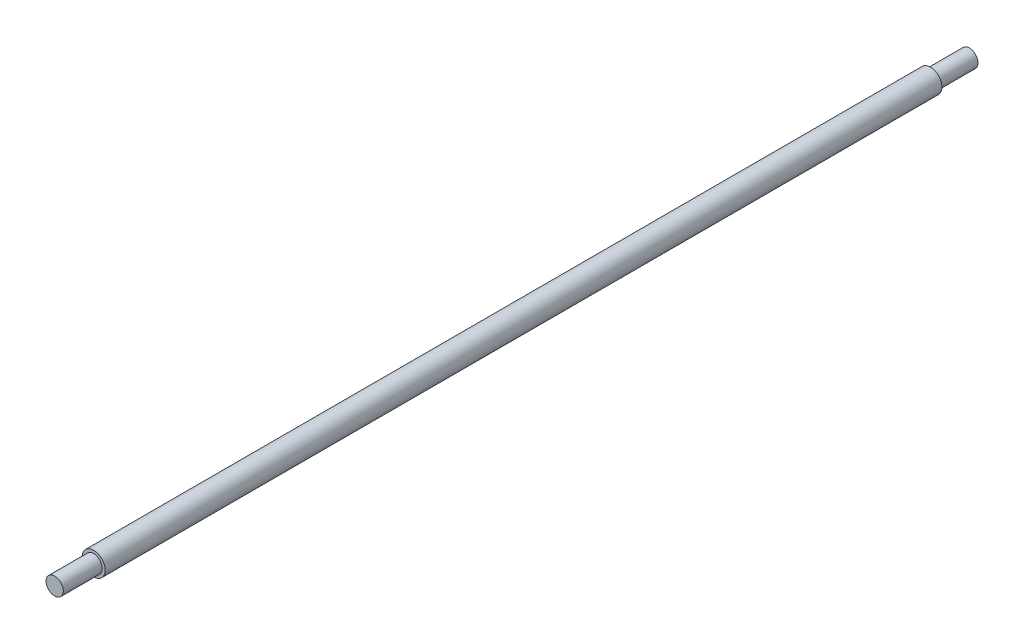
from build123d import *


with BuildPart() as part:
    # Sketch1 → Revolve1 (revolve)
    with BuildSketch(Plane(origin=(0, 0, 0), x_dir=(0, 0, -1), z_dir=(1, 0, 0))):
        Polygon((158.5, 0), (-158.5, 0), (-158.5, 3), (-145, 3), (-145, 4), (145, 4), (145, 3), (158.5, 3), align=None)
    revolve(axis=Axis((0, 0, -158.5), (0, 0, 1)))


solid = part.part
